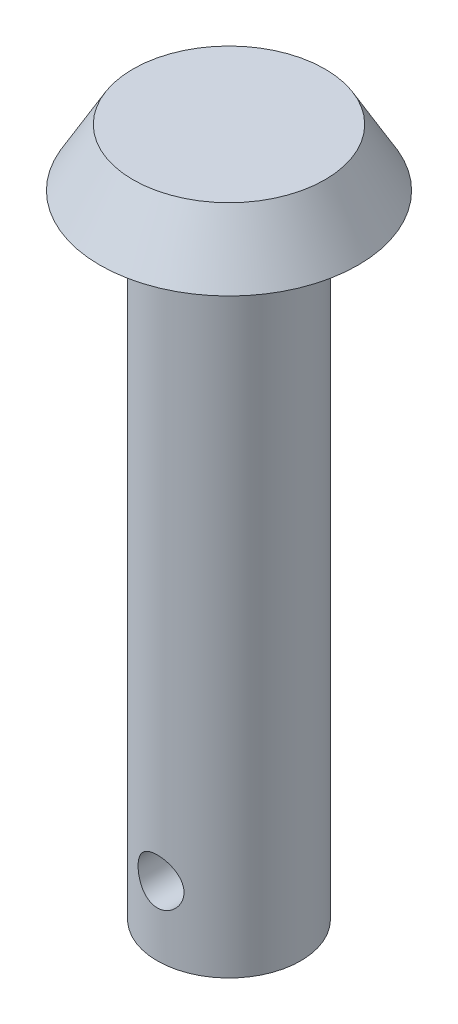
from build123d import *

# Parameters (mm, degrees)
SKETCH1_R           = 12.5
BOSS_EXTRUDE1_DEPTH = 110
SKETCH2_R           = 22.5
BOSS_EXTRUDE2_DEPTH = 10
BOSS_EXTRUDE2_TAPER = 30
SKETCH3_R           = 4
CUT_EXTRUDE1_DEPTH  = 30


with BuildPart() as part:
    # Sketch1 → Boss-Extrude1 (new body)
    with BuildSketch(Plane(origin=(0, 0, 0), x_dir=(1, 0, 0), z_dir=(0, 1, 0))):
        with Locations(Location((0, 0, 0), (0, 0, 270))):
            Circle(SKETCH1_R)
    extrude(amount=BOSS_EXTRUDE1_DEPTH)

    # Sketch2 → Boss-Extrude2 (add)
    with BuildSketch(Plane(origin=(0, 110, 0), x_dir=(1, 0, 0), z_dir=(0, 1, 0))):
        Circle(SKETCH2_R)
    extrude(amount=BOSS_EXTRUDE2_DEPTH, taper=BOSS_EXTRUDE2_TAPER)

    # Sketch3 → Cut-Extrude1 (cut, symmetric)
    with BuildSketch(Plane.XY):
        with Locations(Location((0, 12, 0), (0, 0, 89.99999999))):
            Circle(SKETCH3_R)
    extrude(amount=CUT_EXTRUDE1_DEPTH, both=True, mode=Mode.SUBTRACT)


solid = part.part
